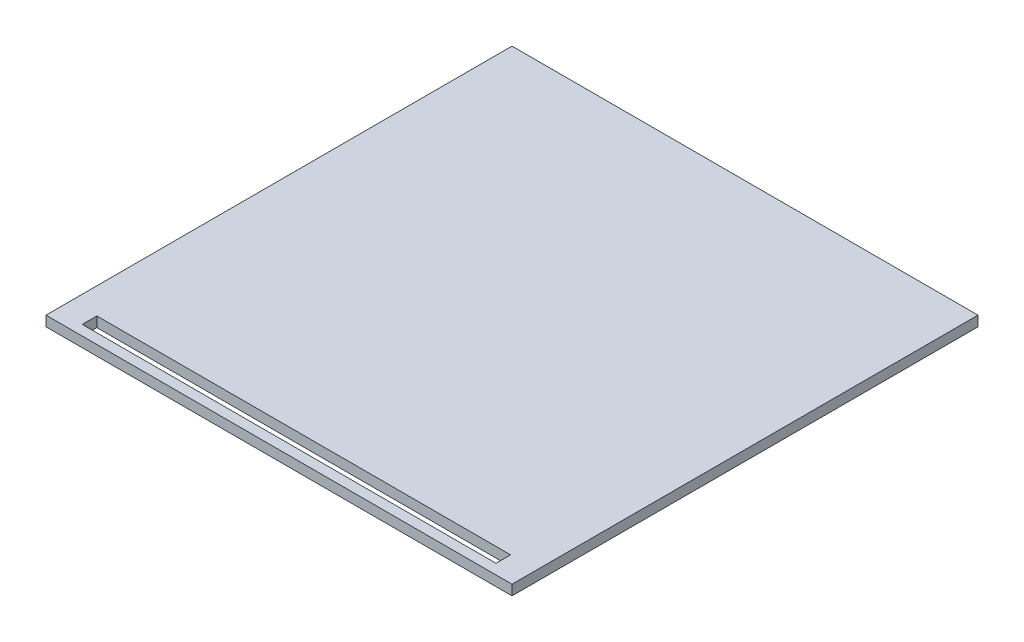
from build123d import *

# Parameters (mm, degrees)
ESQUISSE3_W             = 230
ESQUISSE3_H             = 230
BOSS_EXTRU_1_DEPTH      = 5
ESQUISSE10_W            = 204.2
ESQUISSE10_H            = 7.2
ENL_V_MAT_EXTRU_1_DEPTH = 163.711400953


with BuildPart() as part:
    # Esquisse3 → Boss.-Extru.1 (new body)
    with BuildSketch(Plane(origin=(0, 0, 0), x_dir=(1, 0, 0), z_dir=(0, 1, 0))):
        Rectangle(ESQUISSE3_W, ESQUISSE3_H)
    extrude(amount=BOSS_EXTRU_1_DEPTH)

    # Esquisse10 → Enlèv. mat.-Extru.1 (cut, through all)
    with BuildSketch(Plane(origin=(0, 5, 0), x_dir=(1, 0, 0), z_dir=(0, 1, 0))):
        with Locations((0, -106.4)):
            Rectangle(ESQUISSE10_W, ESQUISSE10_H)
    extrude(amount=-ENL_V_MAT_EXTRU_1_DEPTH, mode=Mode.SUBTRACT)


solid = part.part
